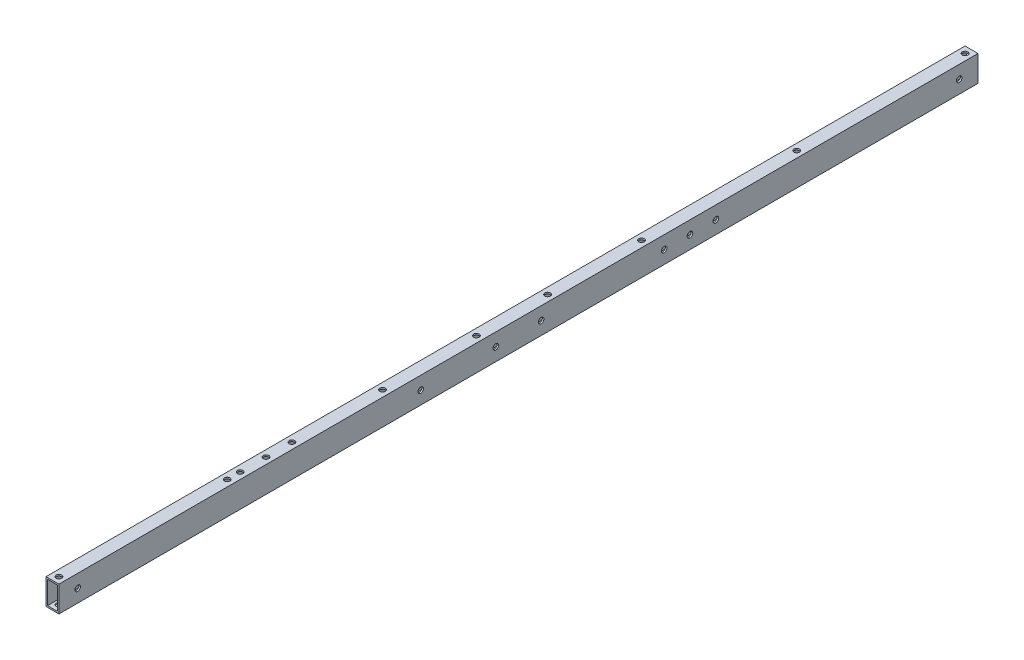
from build123d import *

# Parameters (mm, degrees)
SKETCH_1_W          = 10
SKETCH_1_H          = 20
SKETCH_1_W_2        = 7.6
SKETCH_1_H_2        = 17.6
EXTRUDE_1_DEPTH     = 710
SKETCH_2_R          = 2.15
CUT_EXTRUDE_1_DEPTH = 711.299232718
SKETCH_3_R          = 2.15
CUT_EXTRUDE_2_DEPTH = 711.140831103


with BuildPart() as part:
    # ｽｹｯﾁ1 → 押し出し-薄板1 (new body)
    with BuildSketch(Plane.XY):
        Rectangle(SKETCH_1_W, SKETCH_1_H)
        Rectangle(SKETCH_1_W_2, SKETCH_1_H_2, mode=Mode.SUBTRACT)
    extrude(amount=EXTRUDE_1_DEPTH)

    # ｽｹｯﾁ2 → ｶｯﾄ - 押し出し1 (cut, through all)
    with BuildSketch(Plane(origin=(0, 10, 0), x_dir=(1, 0, 0), z_dir=(0, 1, 0))):
        with Locations(Location((0, -135, 0), (0, 0, 270))):
            Circle(SKETCH_2_R)
        with Locations(Location((0, -5, 0), (0, 0, 270))):
            Circle(SKETCH_2_R)
        with Locations(Location((0, -575, 0), (0, 0, 270))):
            Circle(SKETCH_2_R)
        with Locations(Location((0, -705, 0), (0, 0, 270))):
            Circle(SKETCH_2_R)
        with Locations(Location((0, -255, 0), (0, 0, 270))):
            Circle(SKETCH_2_R)
        with Locations(Location((0, -455, 0), (0, 0, 270))):
            Circle(SKETCH_2_R)
        with Locations(Location((0, -565, 0), (0, 0, 270))):
            Circle(SKETCH_2_R)
        with Locations(Location((0, -525, 0), (0, 0, 270))):
            Circle(SKETCH_2_R)
        with Locations(Location((0, -545, 0), (0, 0, 270))):
            Circle(SKETCH_2_R)
        with Locations(Location((0, -327.5, 0), (0, 0, 270))):
            Circle(SKETCH_2_R)
        with Locations(Location((0, -382.5, 0), (0, 0, 270))):
            Circle(SKETCH_2_R)
    extrude(amount=-CUT_EXTRUDE_1_DEPTH, mode=Mode.SUBTRACT)

    # ｽｹｯﾁ3 → ｶｯﾄ - 押し出し2 (cut, through all)
    with BuildSketch(Plane(origin=(5, 0, 0), x_dir=(0, 0, -1), z_dir=(1, 0, 0))):
        with Locations(Location((-202.5, 0, 0), (0, 0, 90))):
            Circle(SKETCH_3_R)
        with Locations(Location((-222.5, 0, 0), (0, 0, 90))):
            Circle(SKETCH_3_R)
        with Locations(Location((-242.5, 0, 0), (0, 0, 90))):
            Circle(SKETCH_3_R)
        with Locations(Location((-430.5, 0, 0), (0, 0, 90))):
            Circle(SKETCH_3_R)
        with Locations(Location((-14.5, 0, 0), (0, 0, 90))):
            Circle(SKETCH_3_R)
        with Locations(Location((-695.5, 0, 0), (0, 0, 90))):
            Circle(SKETCH_3_R)
        with Locations(Location((-372.5, 0, 0), (0, 0, 90))):
            Circle(SKETCH_3_R)
        with Locations(Location((-337.5, 0, 0), (0, 0, 90))):
            Circle(SKETCH_3_R)
    extrude(amount=-CUT_EXTRUDE_2_DEPTH, mode=Mode.SUBTRACT)


solid = part.part
